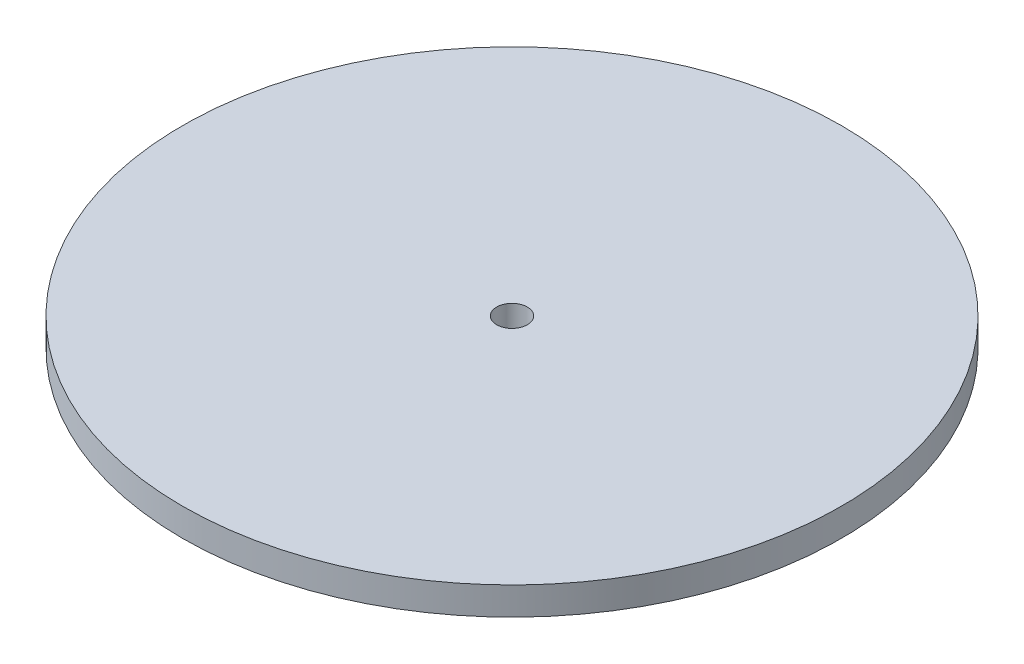
from build123d import *

# Parameters (mm, degrees)
ESQUISSE1_R             = 75
BOSS_EXTRU_1_DEPTH      = 6.35
ESQUISSE2_R             = 3.5
ENL_V_MAT_EXTRU_1_DEPTH = 6.35


with BuildPart() as part:
    # Esquisse1 → Boss.-Extru.1 (new body)
    with BuildSketch(Plane(origin=(0, 0, 0), x_dir=(1, 0, 0), z_dir=(0, 1, 0))):
        with Locations(Location((0, 0, 0), (0, 0, 270))):
            Circle(ESQUISSE1_R)
    extrude(amount=BOSS_EXTRU_1_DEPTH)

    # Esquisse2 → Enlèv. mat.-Extru.1 (cut)
    with BuildSketch(Plane(origin=(0, 6.35, 0), x_dir=(1, 0, 0), z_dir=(0, 1, 0))):
        with Locations(Location((0, 0, 0), (0, 0, 270))):
            Circle(ESQUISSE2_R)
    extrude(amount=-ENL_V_MAT_EXTRU_1_DEPTH, mode=Mode.SUBTRACT)


solid = part.part
